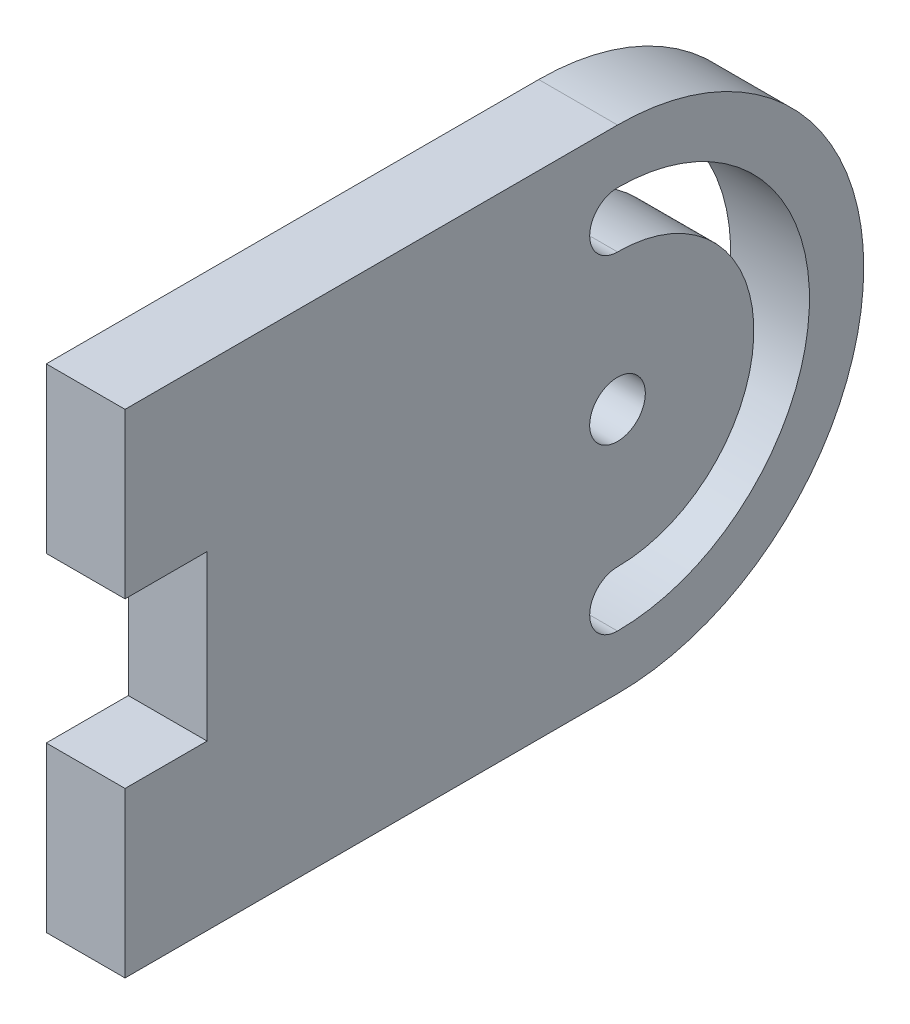
from build123d import *

# Parameters (mm, degrees)
BOSS_EXTRUDE1_DEPTH   = 3.048
F_8_CLEARANCE_HOLE1_D = 4.3053
CUT_EXTRUDE1_DEPTH    = 55.595821415


with BuildPart() as part:
    # Sketch1 → Boss-Extrude1 (new, symmetric)
    with BuildSketch(Plane(origin=(0, 0, 0), x_dir=(0, 0, -1), z_dir=(1, 0, 0))):
        with BuildLine():
            Line((0, 6.35), (0, -6.35))
            Line((0, -6.35), (-6.35, -6.35))
            Line((-6.35, -6.35), (-6.35, -19.05))
            Line((-6.35, -19.05), (31.75, -19.05))
            ThreePointArc((31.75, -19.05), (50.8, 0), (31.75, 19.05))
            Line((31.75, 19.05), (-6.35, 19.05))
            Line((-6.35, 19.05), (-6.35, 6.35))
            Line((-6.35, 6.35), (0, 6.35))
        make_face()
    extrude(amount=BOSS_EXTRUDE1_DEPTH, both=True)

    # #8 Clearance Hole1 (through all)
    with Locations(Plane(origin=(3.048, 0, 0), x_dir=(0, 0, -1), z_dir=(1, 0, 0))):
        with Locations((31.75, 0), (31.75, 12.7), (31.75, -12.7)):
            Hole(F_8_CLEARANCE_HOLE1_D / 2)

    # Sketch5 → Cut-Extrude1 (cut, through all)
    with BuildSketch(Plane(origin=(3.048, 0, 0), x_dir=(0, 0, -1), z_dir=(1, 0, 0))):
        with BuildLine():
            ThreePointArc((33.90265, 12.7), (33.272153413, 11.177846587), (31.75, 10.54735))
            ThreePointArc((31.75, 10.54735), (42.29735, 0), (31.75, -10.54735))
            ThreePointArc((31.75, -10.54735), (33.272153413, -11.177846587), (33.90265, -12.7))
            ThreePointArc((33.90265, -12.7), (33.272153413, -14.222153413), (31.75, -14.85265))
            ThreePointArc((31.75, -14.85265), (46.60265, 0), (31.75, 14.85265))
            ThreePointArc((31.75, 14.85265), (33.272153413, 14.222153413), (33.90265, 12.7))
        make_face()
    extrude(amount=-CUT_EXTRUDE1_DEPTH, mode=Mode.SUBTRACT)


solid = part.part
